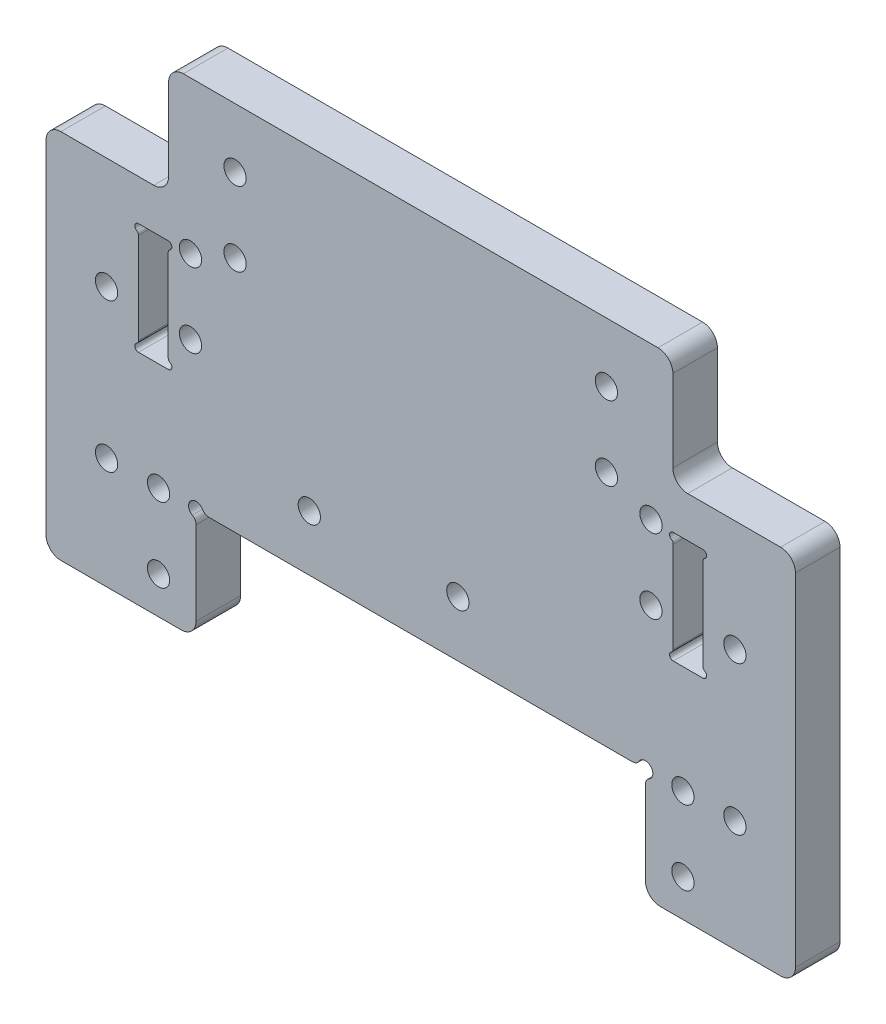
from build123d import *

# Parameters (mm, degrees)
SKETCH_1_W           = 100.9
SKETCH_1_H           = 40
SKETCH_1_R           = 1.5
EXTRUDE_1_DEPTH      = 6
SKETCH_6_W           = 100.9
SKETCH_6_H           = 10
EXTRUDE_2_DEPTH      = 6
SKETCH_2_W           = 60.5
SKETCH_2_H           = 15
CUT_EXTRUDE_1_DEPTH  = 10
SKETCH_3_R           = 1
CUT_EXTRUDE_2_DEPTH  = 10
SKETCH_4_R           = 1.5
CUT_EXTRUDE_3_DEPTH  = 10
SKETCH_5_R           = 1.5
CUT_EXTRUDE_4_DEPTH  = 10
SKETCH_7_W           = 4
SKETCH_7_H           = 15
CUT_EXTRUDE_5_DEPTH  = 6
CUT_EXTRUDE_6_DEPTH  = 6
FILLET_1_R           = 0.5
FILLET_2_R           = 1
SKETCH_9_W           = 100.9
SKETCH_9_H           = 15
EXTRUDE_3_DEPTH      = 6
SKETCH_10_W          = 16.5
SKETCH_10_H          = 15
CUT_EXTRUDE_7_DEPTH  = 6
SKETCH_11_W          = 6
SKETCH_11_H          = 15
EXTRUDE_4_DEPTH      = 20
SKETCH_12_R          = 2.5
CUT_EXTRUDE_8_DEPTH  = 6
SKETCH_13_R          = 1.5
CUT_EXTRUDE_9_DEPTH  = 6
SKETCH_14_R          = 1.5
CUT_EXTRUDE_10_DEPTH = 6
SKETCH_15_W          = 20
SKETCH_15_H          = 2
EXTRUDE_5_DEPTH      = 6
FILLET_4_R           = 2
FILLET_5_R           = 2
SKETCH_19_R          = 4.5
SKETCH_19_R_2        = 2.5
EXTRUDE_6_DEPTH      = 55.9


with BuildPart() as part:
    # 草图1 → 凸台-拉伸1 (new body)
    with BuildSketch(Plane.XY):
        with Locations((0, 10)):
            Rectangle(SKETCH_1_W, SKETCH_1_H)
        with Locations((42.3, 25)):
            Circle(SKETCH_1_R, mode=Mode.SUBTRACT)
        with Locations((42.3, 5)):
            Circle(SKETCH_1_R, mode=Mode.SUBTRACT)
        with Locations((35.3, 5)):
            Circle(SKETCH_1_R, mode=Mode.SUBTRACT)
        with Locations((35.3, -5)):
            Circle(SKETCH_1_R, mode=Mode.SUBTRACT)
        with Locations(Location((-35.3, -5, 0), (0, 0, 180))):
            Circle(SKETCH_1_R, mode=Mode.SUBTRACT)
        with Locations(Location((-35.3, 5, 0), (0, 0, 180))):
            Circle(SKETCH_1_R, mode=Mode.SUBTRACT)
        with Locations(Location((-42.3, 5, 0), (0, 0, 180))):
            Circle(SKETCH_1_R, mode=Mode.SUBTRACT)
        with Locations(Location((-42.3, 25, 0), (0, 0, 180))):
            Circle(SKETCH_1_R, mode=Mode.SUBTRACT)
    extrude(amount=EXTRUDE_1_DEPTH)

    # 草图6 → 凸台-拉伸2 (add)
    with BuildSketch(Plane.XY.offset(6)):
        with Locations((0, 35)):
            Rectangle(SKETCH_6_W, SKETCH_6_H)
    extrude(amount=-EXTRUDE_2_DEPTH)

    # 草图2 → 切除-拉伸1 (cut)
    with BuildSketch(Plane.XY.offset(6)):
        with Locations((0, -2.5)):
            Rectangle(SKETCH_2_W, SKETCH_2_H)
    extrude(amount=-CUT_EXTRUDE_1_DEPTH, mode=Mode.SUBTRACT)

    # 草图3 → 切除-拉伸2 (cut)
    with BuildSketch(Plane.XY.offset(6)):
        with Locations((-30.25, 5)):
            Circle(SKETCH_3_R)
        with Locations((30.25, 5)):
            Circle(SKETCH_3_R)
    extrude(amount=-CUT_EXTRUDE_2_DEPTH, mode=Mode.SUBTRACT)

    # 草图4 → 切除-拉伸3 (cut)
    with BuildSketch(Plane.XY.offset(6)):
        with Locations((31, 34.5)):
            Circle(SKETCH_4_R)
        with Locations((31, 24.5)):
            Circle(SKETCH_4_R)
        with Locations((-31, 24.5)):
            Circle(SKETCH_4_R)
        with Locations((-31, 34.5)):
            Circle(SKETCH_4_R)
    extrude(amount=-CUT_EXTRUDE_3_DEPTH, mode=Mode.SUBTRACT)

    # 草图5 → 切除-拉伸4 (cut)
    with BuildSketch(Plane.XY.offset(6)):
        with Locations((-15, 12.5)):
            Circle(SKETCH_5_R)
        with Locations((5, 12.5)):
            Circle(SKETCH_5_R)
    extrude(amount=-CUT_EXTRUDE_4_DEPTH, mode=Mode.SUBTRACT)

    # 草图7 → 切除-拉伸5 (cut)
    with BuildSketch(Plane.XY.offset(6)):
        with Locations((36, 27)):
            Rectangle(SKETCH_7_W, SKETCH_7_H)
        with Locations((-36, 27)):
            Rectangle(SKETCH_7_W, SKETCH_7_H)
    extrude(amount=-CUT_EXTRUDE_5_DEPTH, mode=Mode.SUBTRACT)

    # 草图8 → 切除-拉伸6 (cut)
    with BuildSketch(Plane.XY.offset(6)):
        with BuildLine():
            Line((-38, 33.5), (-38, 34.5))
            ThreePointArc((-38, 34.5), (-38.5, 34), (-38, 33.5))
        make_face()
        with BuildLine():
            Line((-34, 34.5), (-34, 33.5))
            ThreePointArc((-34, 33.5), (-33.5, 34), (-34, 34.5))
        make_face()
        with BuildLine():
            Line((-38, 19.5), (-38, 20.5))
            ThreePointArc((-38, 20.5), (-38.5, 20), (-38, 19.5))
        make_face()
        with BuildLine():
            Line((-34, 20.5), (-34, 19.5))
            ThreePointArc((-34, 19.5), (-33.5, 20), (-34, 20.5))
        make_face()
        with BuildLine():
            ThreePointArc((38, 33.5), (38.5, 34), (38, 34.5))
            Line((38, 34.5), (38, 33.5))
        make_face()
        with BuildLine():
            ThreePointArc((34, 34.5), (33.5, 34), (34, 33.5))
            Line((34, 33.5), (34, 34.5))
        make_face()
        with BuildLine():
            ThreePointArc((34, 20.5), (33.5, 20), (34, 19.5))
            Line((34, 19.5), (34, 20.5))
        make_face()
        with BuildLine():
            ThreePointArc((38, 19.5), (38.5, 20), (38, 20.5))
            Line((38, 20.5), (38, 19.5))
        make_face()
    extrude(amount=-CUT_EXTRUDE_6_DEPTH, mode=Mode.SUBTRACT)

    # 圆角1
    fillet_1_edges = [part.edges().sort_by_distance(p)[0] for p in [
        (38, 33.5, 3),
        (-34, 20.5, 3),
        (-38, 20.5, 3),
        (-34, 33.5, 3),
        (34, 33.5, 3),
        (34, 20.5, 3),
        (38, 20.5, 3),
        (-38, 33.5, 3),
    ]]
    fillet(fillet_1_edges, radius=FILLET_1_R)

    # 圆角2
    fillet_2_edges = [part.edges().sort_by_distance(p)[0] for p in [
        (-30.25, 4, 3),
        (30.25, 4, 3),
        (-29.25, 5, 3),
        (29.25, 5, 3),
    ]]
    fillet(fillet_2_edges, radius=FILLET_2_R)

    # 草图9 → 凸台-拉伸3 (add)
    with BuildSketch(Plane.XY.offset(6)):
        with Locations((0, 47.5)):
            Rectangle(SKETCH_9_W, SKETCH_9_H)
    extrude(amount=-EXTRUDE_3_DEPTH)

    # 草图10 → 切除-拉伸7 (cut)
    with BuildSketch(Plane.XY.offset(6)):
        with Locations((-42.2, 47.5)):
            Rectangle(SKETCH_10_W, SKETCH_10_H)
        with Locations((42.2, 47.5)):
            Rectangle(SKETCH_10_W, SKETCH_10_H)
    extrude(amount=-CUT_EXTRUDE_7_DEPTH, mode=Mode.SUBTRACT)

    # 草图13 → 切除-拉伸9 (cut)
    with BuildSketch(Plane.XY.offset(6)):
        with Locations((-25, 47)):
            Circle(SKETCH_13_R)
        with Locations((-25, 37)):
            Circle(SKETCH_13_R)
        with Locations((25, 37)):
            Circle(SKETCH_13_R)
        with Locations((25, 47)):
            Circle(SKETCH_13_R)
    extrude(amount=-CUT_EXTRUDE_9_DEPTH, mode=Mode.SUBTRACT)

    # 圆角5
    fillet_5_edges = [part.edges().sort_by_distance(p)[0] for p in [
        (50.45, 40, 3),
        (33.95, 40, 3),
        (33.95, 55, 3),
        (-33.95, 55, 3),
        (-33.95, 40, 3),
        (-50.45, 40, 3),
        (-30.25, -10, 3),
        (30.25, -10, 3),
        (50.45, -10, 3),
        (-50.45, -10, 3),
    ]]
    fillet(fillet_5_edges, radius=FILLET_5_R)


with BuildPart() as body_2:
    # 草图11 → 凸台-拉伸4 (new body)
    with BuildSketch(Plane.XY.offset(6)):
        with Locations((30.95, 47.5)):
            Rectangle(SKETCH_11_W, SKETCH_11_H)
    extrude(amount=EXTRUDE_4_DEPTH)

    # 草图12 → 切除-拉伸8 (cut)
    with BuildSketch(Plane(origin=(33.95, 0, 0), x_dir=(0, 0, -1), z_dir=(1, 0, 0))):
        with Locations((-21, 46.5)):
            Circle(SKETCH_12_R)
    extrude(amount=-CUT_EXTRUDE_8_DEPTH, mode=Mode.SUBTRACT)

    # 草图14 → 切除-拉伸10 (cut)
    with BuildSketch(Plane(origin=(33.95, 0, 0), x_dir=(0, 0, -1), z_dir=(1, 0, 0))):
        with Locations((-9, 42)):
            Circle(SKETCH_14_R)
        with Locations((-9, 52)):
            Circle(SKETCH_14_R)
    extrude(amount=-CUT_EXTRUDE_10_DEPTH, mode=Mode.SUBTRACT)

    # 草图15 → 凸台-拉伸5 (add)
    with BuildSketch(Plane(origin=(33.95, 0, 0), x_dir=(0, 0, -1), z_dir=(1, 0, 0))):
        with Locations((-16, 39)):
            Rectangle(SKETCH_15_W, SKETCH_15_H)
    extrude(amount=-EXTRUDE_5_DEPTH)

    # 圆角4
    fillet_4_edges = [body_2.edges().sort_by_distance(p)[0] for p in [
        (30.95, 55, 26),
        (30.95, 38, 26),
    ]]
    fillet(fillet_4_edges, radius=FILLET_4_R)


with BuildPart() as body_3:
    # 镜向1: mirrored copy
    add(body_2.part.mirror(Plane(origin=(0, 0, 0), x_dir=(0, 0, 1), z_dir=(1, 0, 0))))


with BuildPart() as body_4:
    # 草图19 → 凸台-拉伸6 (new body)
    with BuildSketch(Plane(origin=(-27.95, 0, 0), x_dir=(0, 0, -1), z_dir=(1, 0, 0))):
        with Locations(Location((-21, 46.5, 0), (0, 0, 180))):
            Circle(SKETCH_19_R)
        with Locations((-21, 46.5)):
            Circle(SKETCH_19_R_2, mode=Mode.SUBTRACT)
    extrude(amount=EXTRUDE_6_DEPTH)


solid = part.part
